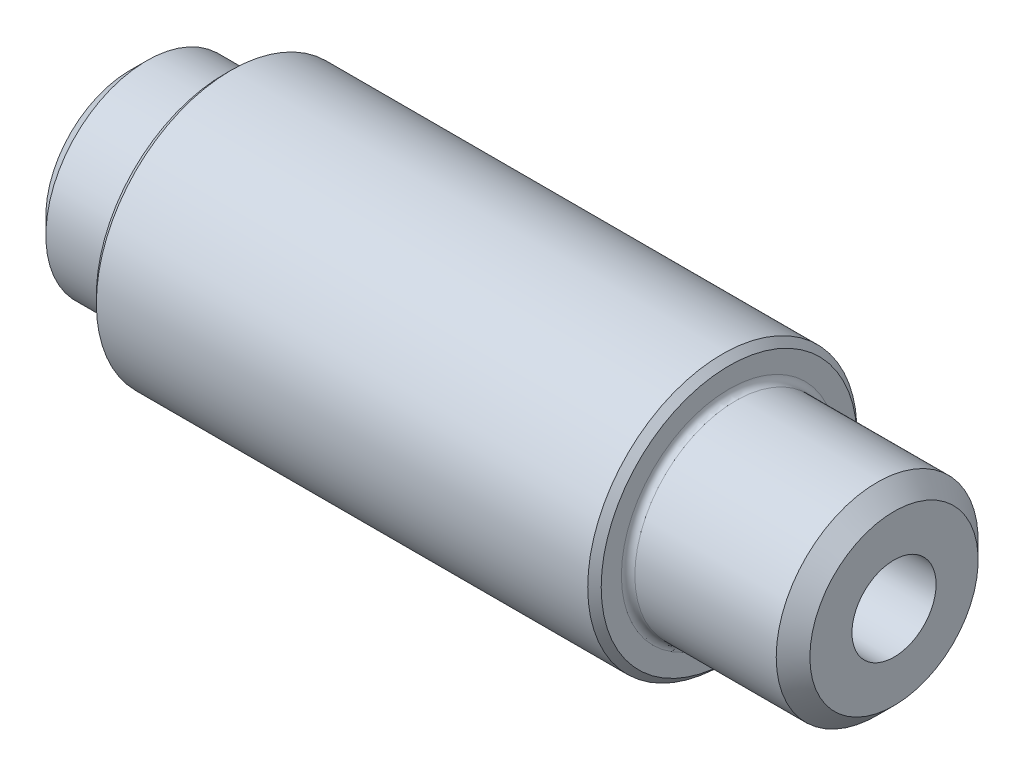
from build123d import *

# Parameters (mm, degrees)
TAPPED_HOLE1_D     = 2.5
TAPPED_HOLE1_DEPTH = 8.5
TAPPED_HOLE1_TIP   = 0.751075774
TAPPED_HOLE2_D     = 2.5
TAPPED_HOLE2_DEPTH = 8.5
TAPPED_HOLE2_TIP   = 0.751075774
CHAMFER1_SIZE      = 0.2
CHAMFER2_SIZE      = 0.2
CHAMFER3_SIZE      = 0.5
FILLET1_R          = 0.2
FILLET2_R          = 0.2


with BuildPart() as part:
    # Sketch1 → Revolve1 (revolve)
    with BuildSketch(Plane.XY):
        Polygon((0, 0), (22.7, 0), (22.7, 3), (17.8, 3), (17.8, 4), (2.8, 4), (2.8, 3), (0, 3), align=None)
    revolve(axis=Axis((0, 0, 0), (1, 0, 0)))

    # Tapped Hole1
    with Locations(Plane.ZY):
        with Locations((0, 0)):
            Hole(TAPPED_HOLE1_D / 2, depth=TAPPED_HOLE1_DEPTH)
            with Locations((0, 0, -(TAPPED_HOLE1_DEPTH + TAPPED_HOLE1_TIP / 2))):  # 118° drill point
                Cone(0, TAPPED_HOLE1_D / 2, TAPPED_HOLE1_TIP, mode=Mode.SUBTRACT)

    # Tapped Hole2
    with Locations(Plane(origin=(22.7, 0, 0), x_dir=(0, 0, -1), z_dir=(1, 0, 0))):
        with Locations((0, 0)):
            Hole(TAPPED_HOLE2_D / 2, depth=TAPPED_HOLE2_DEPTH)
            with Locations((0, 0, -(TAPPED_HOLE2_DEPTH + TAPPED_HOLE2_TIP / 2))):  # 118° drill point
                Cone(0, TAPPED_HOLE2_D / 2, TAPPED_HOLE2_TIP, mode=Mode.SUBTRACT)

    # Chamfer1
    chamfer1_edges = [part.edges().sort_by_distance(p)[0] for p in [
        (17.8, -4, 0),
    ]]
    chamfer(chamfer1_edges, length=CHAMFER1_SIZE)

    # Chamfer2
    chamfer2_edges = [part.edges().sort_by_distance(p)[0] for p in [
        (2.8, -4, 0),
    ]]
    chamfer(chamfer2_edges, length=CHAMFER2_SIZE)

    # Chamfer3
    chamfer3_edges = [part.edges().sort_by_distance(p)[0] for p in [
        (22.7, -3, 0),
        (0, -3, 0),
    ]]
    chamfer(chamfer3_edges, length=CHAMFER3_SIZE)

    # Fillet1
    fillet1_edges = [part.edges().sort_by_distance(p)[0] for p in [
        (2.8, -3, 0),
    ]]
    fillet(fillet1_edges, radius=FILLET1_R)

    # Fillet2
    fillet2_edges = [part.edges().sort_by_distance(p)[0] for p in [
        (17.8, -3, 0),
    ]]
    fillet(fillet2_edges, radius=FILLET2_R)


solid = part.part
